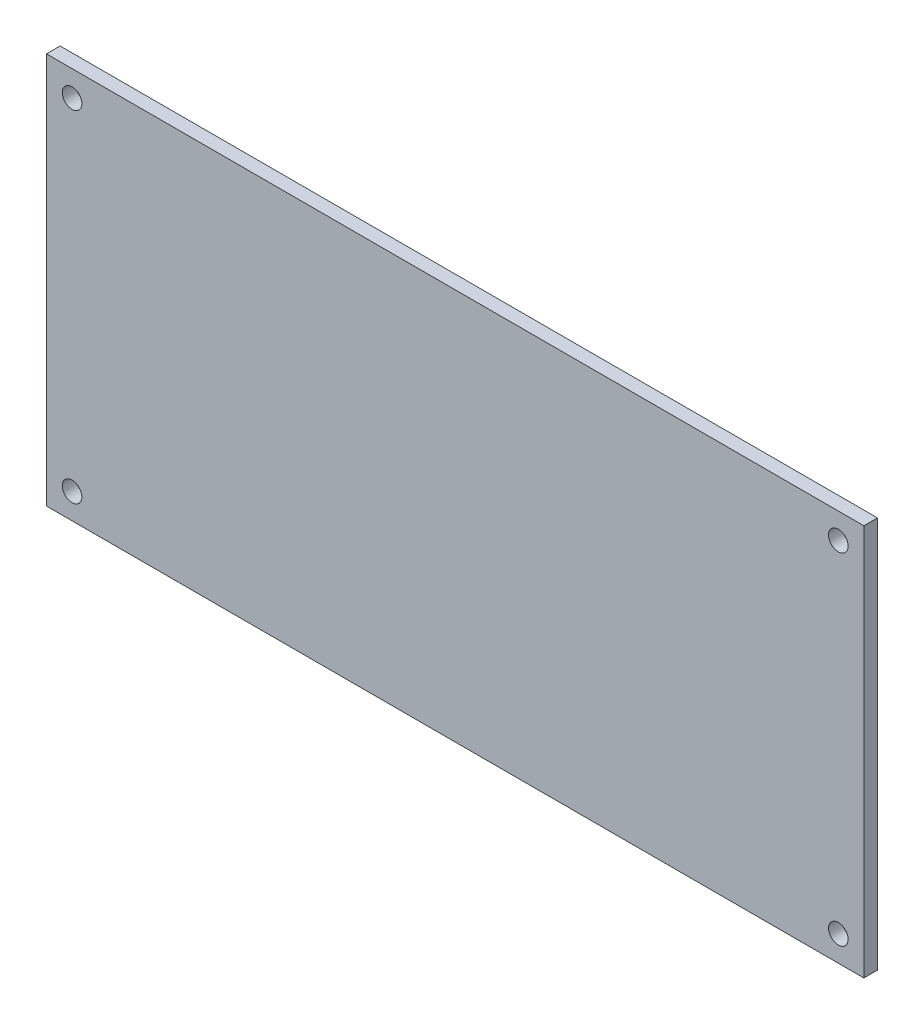
from build123d import *

# Parameters (mm, degrees)
ESQUISSE1_W        = 96
ESQUISSE1_H        = 46
ESQUISSE1_R        = 1.15
BOSS_EXTRU_1_DEPTH = 1.6


with BuildPart() as part:
    # Esquisse1 → Boss.-Extru.1 (new body)
    with BuildSketch(Plane.XY):
        Rectangle(ESQUISSE1_W, ESQUISSE1_H)
        with Locations((-45, 20)):
            Circle(ESQUISSE1_R, mode=Mode.SUBTRACT)
        with Locations(Location((45, 20, 0), (0, 0, 180))):
            Circle(ESQUISSE1_R, mode=Mode.SUBTRACT)
        with Locations(Location((-45, -20, 0), (0, 0, 180))):
            Circle(ESQUISSE1_R, mode=Mode.SUBTRACT)
        with Locations((45, -20)):
            Circle(ESQUISSE1_R, mode=Mode.SUBTRACT)
    extrude(amount=BOSS_EXTRU_1_DEPTH)


solid = part.part
